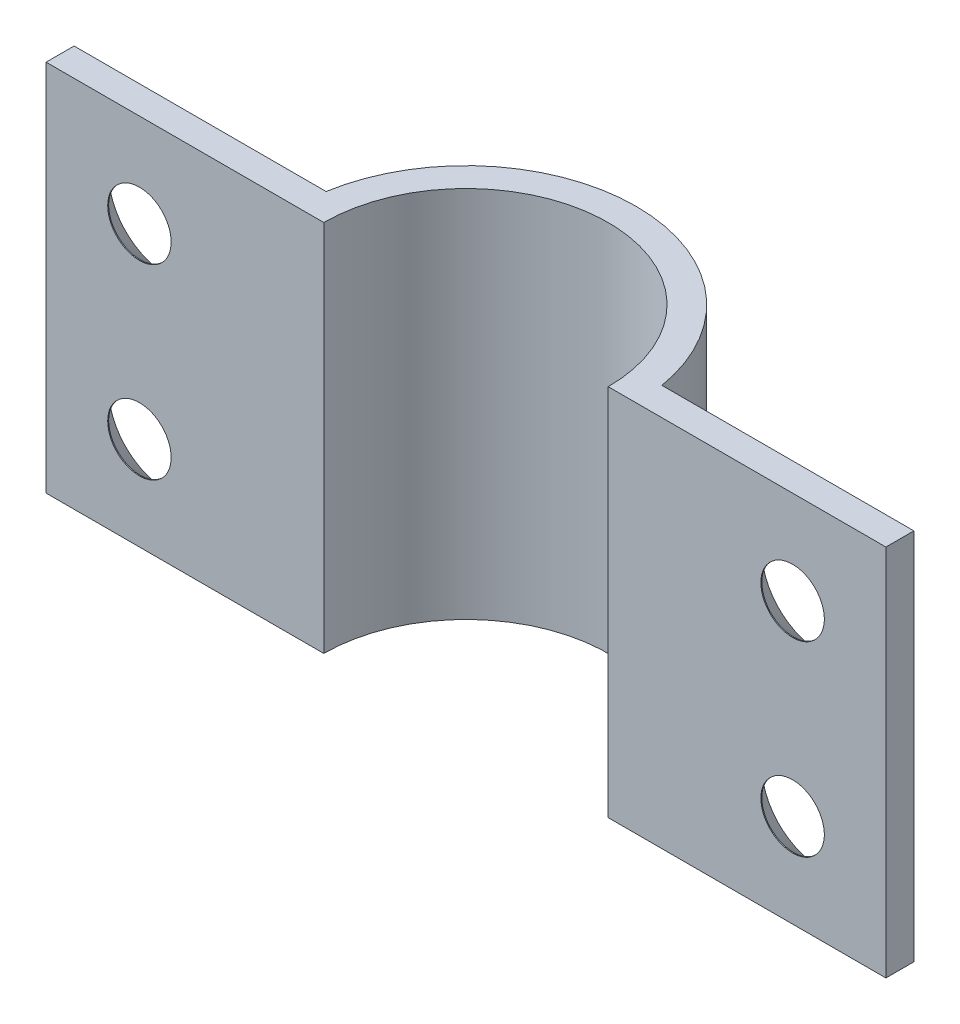
from build123d import *

# Parameters (mm, degrees)
BOSS_EXTRUDE1_DEPTH                          = 20
CSK_FOR_M3_COUNTERSUNK_FLAT_HEAD_SCR_2_COUNT = 2
CSK_FOR_M3_COUNTERSUNK_FLAT_HEAD_SCR_2_PITCH = 35
CSK_FOR_M3_COUNTERSUNK_FLAT_HEAD_SCR_3_COUNT = 2
CSK_FOR_M3_COUNTERSUNK_FLAT_HEAD_SCR_3_PITCH = 10
CSK_FOR_M3_COUNTERSUNK_FLAT_HEAD_SCR_4_COUNT = 2
CSK_FOR_M3_COUNTERSUNK_FLAT_HEAD_SCR_4_PITCH = 36.400549446


with BuildPart() as part:
    # Sketch1 → Boss-Extrude1 (new body)
    with BuildSketch(Plane(origin=(0, 0, 0), x_dir=(1, 0, 0), z_dir=(0, 1, 0))):
        with BuildLine():
            Line((-7.62, 0), (-22.5, 0))
            Line((-22.5, 0), (-22.5, 1.5))
            Line((-22.5, 1.5), (-8.99579902, 1.5))
            ThreePointArc((-8.99579902, 1.5), (0, 9.12), (8.99579902, 1.5))
            Line((8.99579902, 1.5), (22.5, 1.5))
            Line((22.5, 1.5), (22.5, 0))
            Line((22.5, 0), (7.62, 0))
            ThreePointArc((7.62, 0), (0, 7.62), (-7.62, 0))
        make_face()
    extrude(amount=BOSS_EXTRUDE1_DEPTH)

    # Sketch3 → CSK for M3 Countersunk Flat Head Screw1 (revolve, cut)
    with BuildSketch(Plane(origin=(17.5, 5, -1.5), x_dir=(0, 1, 0), z_dir=(1, 0, 0))):
        Polygon((0, 0), (0, 1.5), (1.7, 1.5), (1.7, 1.45), (3.15, 0), align=None)
    csk_for_m3_countersunk_flat_head_screw1 = revolve(axis=Axis((17.5, 5, -7.85), (0, 0, 1)), mode=Mode.SUBTRACT)

    # CSK for M3 Countersunk Flat Head Scr 2: CSK for M3 Countersunk Flat Head Screw1 ×2
    with Locations(*[(-i * CSK_FOR_M3_COUNTERSUNK_FLAT_HEAD_SCR_2_PITCH, 0, 0) for i in range(1, CSK_FOR_M3_COUNTERSUNK_FLAT_HEAD_SCR_2_COUNT)]):
        add(csk_for_m3_countersunk_flat_head_screw1, mode=Mode.SUBTRACT)

    # CSK for M3 Countersunk Flat Head Scr 3: CSK for M3 Countersunk Flat Head Screw1 ×2
    with Locations(*[(0, i * CSK_FOR_M3_COUNTERSUNK_FLAT_HEAD_SCR_3_PITCH, 0) for i in range(1, CSK_FOR_M3_COUNTERSUNK_FLAT_HEAD_SCR_3_COUNT)]):
        add(csk_for_m3_countersunk_flat_head_screw1, mode=Mode.SUBTRACT)

    # CSK for M3 Countersunk Flat Head Scr 4: CSK for M3 Countersunk Flat Head Screw1 ×2
    with Locations(*[Vector(-0.9615239476408232, 0.27472112789737807, 0) * (i * CSK_FOR_M3_COUNTERSUNK_FLAT_HEAD_SCR_4_PITCH) for i in range(1, CSK_FOR_M3_COUNTERSUNK_FLAT_HEAD_SCR_4_COUNT)]):
        add(csk_for_m3_countersunk_flat_head_screw1, mode=Mode.SUBTRACT)


solid = part.part
